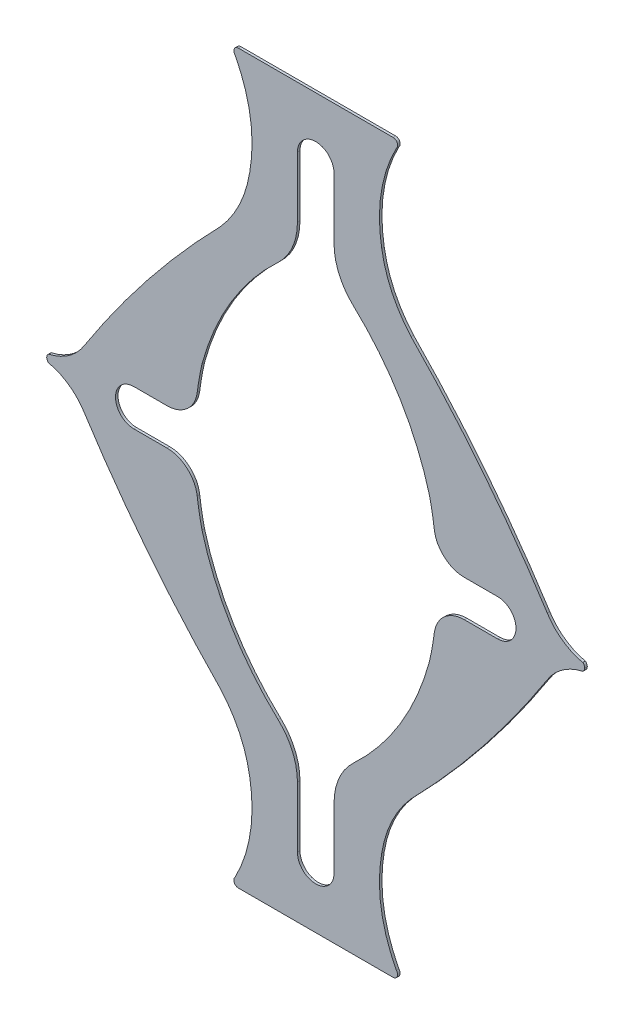
from build123d import *

# Parameters (mm, degrees)
BOSS_EXTRUDE1_DEPTH = 6.35


with BuildPart() as part:
    # Model → Boss-Extrude1 (new body)
    with BuildSketch(Plane.XY):
        with BuildLine():
            Line((-1e-09, 914.4), (-194.479849893, 914.4))
            ThreePointArc((-194.479849893, 914.4), (-204.918872942, 907.625287079), (-202.98320057, 895.332073104))
            ThreePointArc((-202.98320057, 895.332073104), (-164.535916974, 779.903104595), (-165.892020398, 658.247026365))
            Line((-165.892020398, 658.247026365), (-165.93888619, 658.129795087))
            ThreePointArc((-165.93888619, 658.129795087), (-191.627212467, 575.297388544), (-239.683438481, 503.105305724))
            ThreePointArc((-239.683438481, 503.105305724), (-421.799875665, 296.628923535), (-582.037423101, 72.747657041))
            ThreePointArc((-582.037423101, 72.747657041), (-620.33909224, 32.211350911), (-671.307126154, 9.573561873))
            ThreePointArc((-671.307126154, 9.573561873), (-674.990888605, 5.409489793), (-676.274252254, 0))
            ThreePointArc((-676.274252254, 0), (-674.990888605, -5.409489793), (-671.307126154, -9.573561873))
            ThreePointArc((-671.307126154, -9.573561873), (-620.33909224, -32.211350911), (-582.037423101, -72.747657041))
            ThreePointArc((-582.037423101, -72.747657041), (-421.799875665, -296.628923535), (-239.683438481, -503.105305724))
            ThreePointArc((-239.683438481, -503.105305724), (-191.627212467, -575.297388544), (-165.93888619, -658.129795087))
            Line((-165.93888619, -658.129795087), (-165.892020398, -658.247026365))
            ThreePointArc((-165.892020398, -658.247026365), (-164.535916974, -779.903104595), (-202.98320057, -895.332073104))
            ThreePointArc((-202.98320057, -895.332073104), (-204.918872942, -907.625287079), (-194.479849893, -914.4))
            Line((-194.479849893, -914.4), (-1e-09, -914.4))
            Line((-1e-09, -914.4), (194.47984989, -914.4))
            ThreePointArc((194.47984989, -914.4), (204.918872939, -907.625287079), (202.983200567, -895.332073104))
            ThreePointArc((202.983200567, -895.332073104), (164.535916972, -779.903104595), (165.892020395, -658.247026365))
            Line((165.892020395, -658.247026365), (165.938886187, -658.129795086))
            ThreePointArc((165.938886187, -658.129795086), (191.627212464, -575.297388544), (239.683438478, -503.105305724))
            ThreePointArc((239.683438478, -503.105305724), (421.79987566, -296.628923537), (582.037423094, -72.747657046))
            ThreePointArc((582.037423094, -72.747657046), (620.339092235, -32.211350913), (671.307126151, -9.573561873))
            ThreePointArc((671.307126151, -9.573561873), (674.990888602, -5.409489793), (676.274252251, 0))
            ThreePointArc((676.274252251, 0), (674.990888602, 5.409489793), (671.307126151, 9.573561873))
            ThreePointArc((671.307126151, 9.573561873), (620.339092237, 32.211350911), (582.037423097, 72.747657043))
            ThreePointArc((582.037423097, 72.747657043), (421.799875662, 296.628923535), (239.683438478, 503.105305724))
            ThreePointArc((239.683438478, 503.105305724), (191.627212464, 575.297388544), (165.938886187, 658.129795087))
            Line((165.938886187, 658.129795087), (165.892020395, 658.247026365))
            ThreePointArc((165.892020395, 658.247026365), (164.535916972, 779.903104595), (202.983200567, 895.332073104))
            ThreePointArc((202.983200567, 895.332073104), (204.918872939, 907.625287079), (194.47984989, 914.4))
            Line((194.47984989, 914.4), (-1e-09, 914.4))
        make_face()
        with BuildLine():
            Line((-46.0375, -761.999999999), (-46.0375, -609.361109078))
            ThreePointArc((-46.0375, -609.361109078), (-58.756065659, -548.411483153), (-94.788902893, -497.634978214))
            ThreePointArc((-94.788902893, -497.634978214), (-212.726110253, -352.63455945), (-285.980677563, -180.680860187))
            ThreePointArc((-285.980677563, -180.680860187), (-292.839641189, -146.846450496), (-298.006194276, -112.712605264))
            ThreePointArc((-298.006194276, -112.712605264), (-323.20694899, -65.087535088), (-373.608551252, -46.0375))
            Line((-373.608551252, -46.0375), (-457.356144829, -46.0375))
            ThreePointArc((-457.356144829, -46.0375), (-503.393644829, 0), (-457.356144829, 46.0375))
            Line((-457.356144829, 46.0375), (-373.608551252, 46.0375))
            ThreePointArc((-373.608551252, 46.0375), (-323.20694899, 65.087535088), (-298.006194276, 112.712605264))
            ThreePointArc((-298.006194276, 112.712605264), (-292.839641189, 146.846450496), (-285.980677563, 180.680860188))
            ThreePointArc((-285.980677563, 180.680860188), (-212.726110253, 352.63455945), (-94.788902893, 497.634978214))
            ThreePointArc((-94.788902893, 497.634978214), (-58.756065659, 548.411483153), (-46.0375, 609.361109078))
            Line((-46.0375, 609.361109078), (-46.0375, 761.999999999))
            ThreePointArc((-46.0375, 761.999999999), (0, 808.037499999), (46.0375, 761.999999999))
            Line((46.0375, 761.999999999), (46.0375, 609.361109078))
            ThreePointArc((46.0375, 609.361109078), (58.756065659, 548.411483153), (94.788902893, 497.634978214))
            ThreePointArc((94.788902893, 497.634978214), (212.726110253, 352.63455945), (285.980677563, 180.680860188))
            ThreePointArc((285.980677563, 180.680860188), (292.839641189, 146.846450496), (298.006194276, 112.712605264))
            ThreePointArc((298.006194276, 112.712605264), (323.20694899, 65.087535088), (373.608551252, 46.0375))
            Line((373.608551252, 46.0375), (457.356144829, 46.0375))
            ThreePointArc((457.356144829, 46.0375), (503.393644829, 0), (457.356144829, -46.0375))
            Line((457.356144829, -46.0375), (373.608551252, -46.0375))
            ThreePointArc((373.608551252, -46.0375), (323.20694899, -65.087535088), (298.006194276, -112.712605264))
            ThreePointArc((298.006194276, -112.712605264), (292.839641189, -146.846450497), (285.980677563, -180.680860188))
            ThreePointArc((285.980677563, -180.680860188), (212.726110253, -352.63455945), (94.788902893, -497.634978214))
            ThreePointArc((94.788902893, -497.634978214), (58.756065659, -548.411483153), (46.0375, -609.361109078))
            Line((46.0375, -609.361109078), (46.0375, -761.999999999))
            ThreePointArc((46.0375, -761.999999999), (0, -808.037499999), (-46.0375, -761.999999999))
        make_face(mode=Mode.SUBTRACT)
    extrude(amount=BOSS_EXTRUDE1_DEPTH)


solid = part.part
